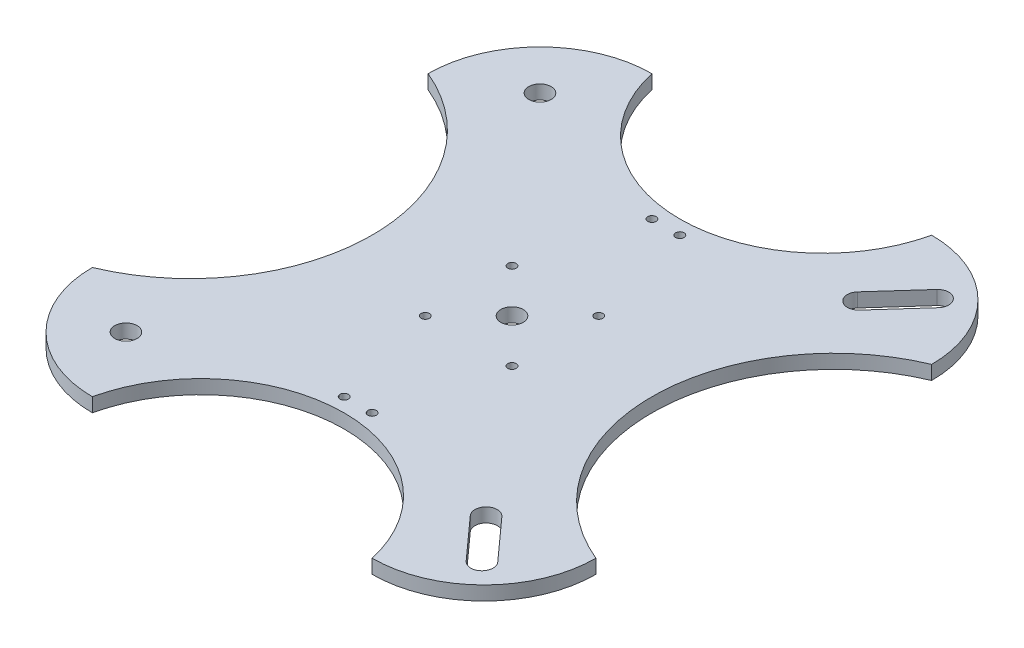
from build123d import *

# Parameters (mm, degrees)
SCHIZZO1_R                   = 4
ESTRUSIONE_ESTRUSIONE1_DEPTH = 5
SCHIZZO2_R                   = 1.5
TAGLIO_ESTRUSIONE1_DEPTH     = 135.629120178
SCHIZZO3_R                   = 1.5
TAGLIO_ESTRUSIONE2_DEPTH     = 135.629120178


with BuildPart() as part:
    # Schizzo1 → Estrusione-Estrusione1 (new body)
    with BuildSketch(Plane(origin=(0, 0, 0), x_dir=(1, 0, 0), z_dir=(0, 1, 0))):
        with BuildLine():
            ThreePointArc((-50, 100), (-78.284271247, 88.284271247), (-90, 60))
            ThreePointArc((-90, 60), (-50, 0), (-90, -60))
            ThreePointArc((-90, -60), (-78.284271247, -88.284271247), (-50, -100))
            ThreePointArc((-50, -100), (0, -60), (50, -100))
            ThreePointArc((50, -100), (78.284271247, -88.284271247), (90, -60))
            ThreePointArc((90, -60), (50, 0), (90, 60))
            ThreePointArc((90, 60), (78.284271247, 88.284271247), (50, 100))
            ThreePointArc((50, 100), (0, 60), (-50, 100))
        make_face()
        with Locations(Location((-64, 74, 0), (0, 0, 270))):
            Circle(SCHIZZO1_R, mode=Mode.SUBTRACT)
        with Locations(Location((-64, -74, 0), (0, 0, 270))):
            Circle(SCHIZZO1_R, mode=Mode.SUBTRACT)
        with Locations(Location((0, 0, 0), (0, 0, 270))):
            Circle(SCHIZZO1_R, mode=Mode.SUBTRACT)
        with BuildLine():
            Line((73.662823901, -78.757082536), (60.283529269, -63.891199611))
            ThreePointArc((60.283529269, -63.891199611), (54.634493757, -63.593881953), (54.337176099, -69.242917464))
            Line((54.337176099, -69.242917464), (67.716470731, -84.108800389))
            ThreePointArc((67.716470731, -84.108800389), (73.365506243, -84.406118047), (73.662823901, -78.757082536))
        make_face(mode=Mode.SUBTRACT)
        with BuildLine():
            Line((60.283529269, 63.891199611), (73.662823901, 78.757082536))
            ThreePointArc((73.662823901, 78.757082536), (73.365506243, 84.406118047), (67.716470731, 84.108800389))
            Line((67.716470731, 84.108800389), (54.337176099, 69.242917464))
            ThreePointArc((54.337176099, 69.242917464), (54.634493757, 63.593881953), (60.283529269, 63.891199611))
        make_face(mode=Mode.SUBTRACT)
    extrude(amount=ESTRUSIONE_ESTRUSIONE1_DEPTH)

    # Schizzo2 → Taglio-Estrusione1 (cut, through all)
    with BuildSketch(Plane(origin=(0, 5, 0), x_dir=(1, 0, 0), z_dir=(0, 1, 0))):
        with Locations(Location((-15.5, 15.5, 0), (0, 0, 270))):
            Circle(SCHIZZO2_R)
        with Locations(Location((15.5, 15.5, 0), (0, 0, 270))):
            Circle(SCHIZZO2_R)
        with Locations(Location((15.5, -15.5, 0), (0, 0, 270))):
            Circle(SCHIZZO2_R)
        with Locations(Location((-15.5, -15.5, 0), (0, 0, 270))):
            Circle(SCHIZZO2_R)
    extrude(amount=-TAGLIO_ESTRUSIONE1_DEPTH, mode=Mode.SUBTRACT)

    # Schizzo3 → Taglio-Estrusione2 (cut, through all)
    with BuildSketch(Plane(origin=(0, 5, 0), x_dir=(1, 0, 0), z_dir=(0, 1, 0))):
        with Locations(Location((-5, 55, 0), (0, 0, 270))):
            Circle(SCHIZZO3_R)
        with Locations(Location((5, 55, 0), (0, 0, 270))):
            Circle(SCHIZZO3_R)
        with Locations(Location((-5, -55, 0), (0, 0, 270))):
            Circle(SCHIZZO3_R)
        with Locations(Location((5, -55, 0), (0, 0, 270))):
            Circle(SCHIZZO3_R)
    extrude(amount=-TAGLIO_ESTRUSIONE2_DEPTH, mode=Mode.SUBTRACT)


solid = part.part
